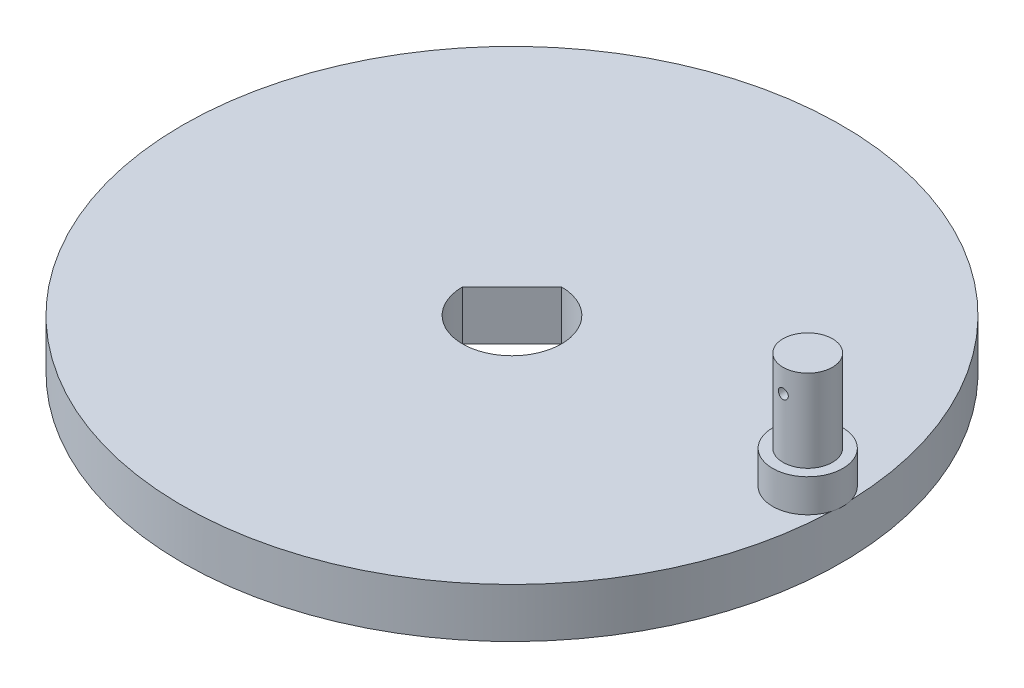
from build123d import *

# Parameters (mm, degrees)
SKETCH2_R               = 20
SKETCH2_R_2             = 3
BOSS_EXTRUDE1_DEPTH     = 3
BOSS_EXTRUDE2_START     = 3
SKETCH5_R               = 1.5
BOSS_EXTRUDE2_DEPTH     = 7
CUT_EXTRUDE1_DEPTH      = 8
CUT_EXTRUDE1_DEPTH_BACK = 8
SKETCH6_R               = 0.300327284
BOSS_EXTRUDE3_DEPTH     = 3
SKETCH8_R               = 2.130430509
BOSS_EXTRUDE4_DEPTH     = 2


with BuildPart() as part:
    # Sketch2 → Boss-Extrude1 (new body)
    with BuildSketch(Plane(origin=(0, 0, 0), x_dir=(1, 0, 0), z_dir=(0, 1, 0))):
        with Locations(Location((0, 0, 0), (0, 0, 270))):
            Circle(SKETCH2_R)
        with Locations(Location((0, 0, 0), (0, 0, 270))):
            Circle(SKETCH2_R_2, mode=Mode.SUBTRACT)
    extrude(amount=BOSS_EXTRUDE1_DEPTH)

    # Sketch5 → Boss-Extrude2 (add)
    with BuildSketch(Plane(origin=(0, 0, 0), x_dir=(1, 0, 0), z_dir=(0, 1, 0)).offset(BOSS_EXTRUDE2_START)):
        with Locations(Location((17.949264284, 0, 0), (0, 0, 270))):
            Circle(SKETCH5_R)
    extrude(amount=BOSS_EXTRUDE2_DEPTH)

    # Sketch6 → Cut-Extrude1 (cut, two sides: drawn at the far end of the back side and taken through both)
    with BuildSketch(Plane.XY.offset(-CUT_EXTRUDE1_DEPTH_BACK)):
        with Locations(Location((17.939875417, 8.605457477, 0), (0, 0, 180))):
            Circle(SKETCH6_R)
    extrude(amount=CUT_EXTRUDE1_DEPTH + CUT_EXTRUDE1_DEPTH_BACK, mode=Mode.SUBTRACT)

    # Sketch7 → Boss-Extrude3 (add)
    with BuildSketch(Plane(origin=(0, 0, 0), x_dir=(1, 0, 0), z_dir=(0, 1, 0))):
        with BuildLine():
            Line((-3, 0), (0, 3))
            ThreePointArc((0, 3), (-2.121320344, 2.121320344), (-3, 0))
        make_face()
    extrude(amount=BOSS_EXTRUDE3_DEPTH)

    # Sketch8 → Boss-Extrude4 (add)
    with BuildSketch(Plane(origin=(0, 3, 0), x_dir=(1, 0, 0), z_dir=(0, 1, 0))):
        with Locations(Location((17.949264284, 0, 0), (0, 0, 16.617512863))):
            Circle(SKETCH8_R)
    extrude(amount=BOSS_EXTRUDE4_DEPTH)


solid = part.part
